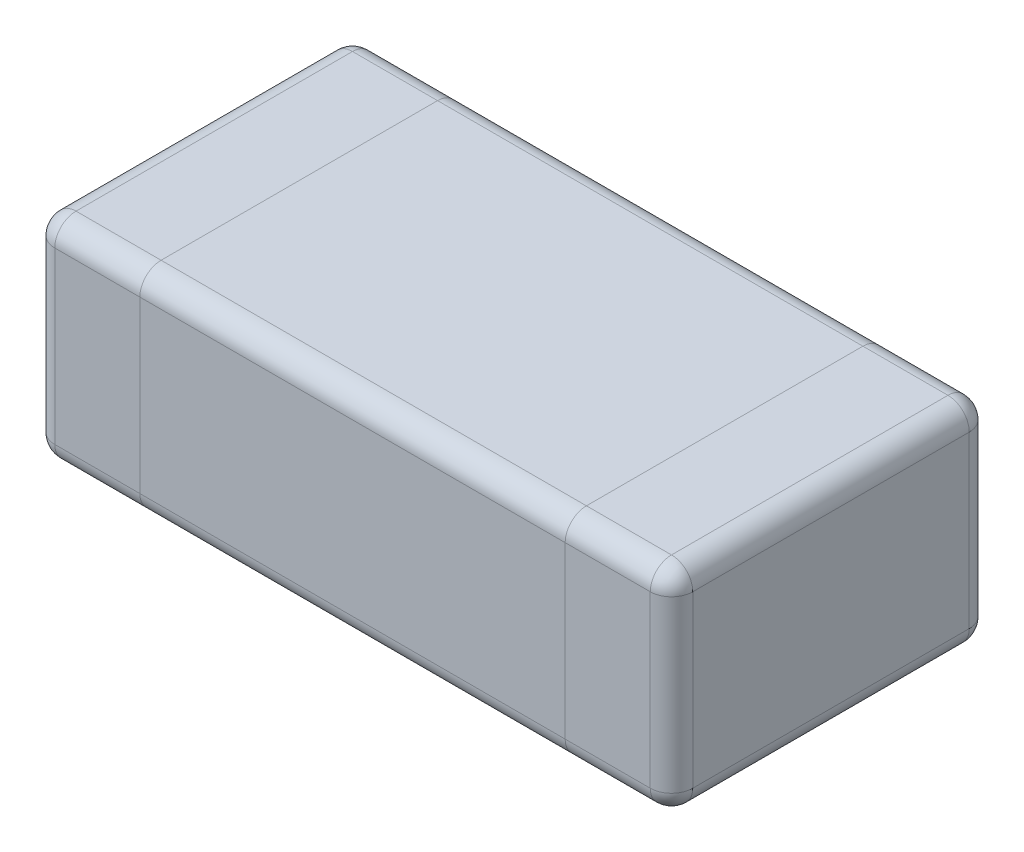
from build123d import *

# Parameters (mm, degrees)
SKETCH1_W           = 0.4
SKETCH1_H           = 0.2
BOSS_EXTRUDE1_DEPTH = 0.3
FILLET1_R           = 0.02
BOSS_EXTRUDE2_DEPTH = 0.1
FILLET2_R           = 0.02


with BuildPart() as part:
    # Sketch1 → Boss-Extrude1 (new body)
    with BuildSketch(Plane.XY):
        with Locations((0, 0.1)):
            Rectangle(SKETCH1_W, SKETCH1_H)
    extrude(amount=BOSS_EXTRUDE1_DEPTH)

    # Fillet1
    fillet1_edges = [part.edges().sort_by_distance(p)[0] for p in [
        (0, 0.2, 0.3),
        (0, 0.2, 0),
        (0, 0, 0),
        (0, 0, 0.3),
    ]]
    fillet(fillet1_edges, radius=FILLET1_R)


with BuildPart() as body_2:
    # Sketch2 → Boss-Extrude2 (new body)
    with BuildSketch(Plane.ZY.offset(0.2)):
        with BuildLine():
            Line((0, 0.18), (0, 0.02))
            ThreePointArc((0, 0.02), (0.005857864, 0.005857864), (0.02, 0))
            Line((0.02, 0), (0.28, 0))
            ThreePointArc((0.28, 0), (0.294142136, 0.005857864), (0.3, 0.02))
            Line((0.3, 0.02), (0.3, 0.18))
            ThreePointArc((0.3, 0.18), (0.294142136, 0.194142136), (0.28, 0.2))
            Line((0.28, 0.2), (0.02, 0.2))
            ThreePointArc((0.02, 0.2), (0.005857864, 0.194142136), (0, 0.18))
        make_face()
    extrude(amount=BOSS_EXTRUDE2_DEPTH)

    # Fillet2
    fillet2_edges = [body_2.edges().sort_by_distance(p)[0] for p in [
        (-0.3, 0.005857864, 0.005857864),
        (-0.3, 0, 0.15),
        (-0.3, 0.005857864, 0.294142136),
        (-0.3, 0.1, 0.3),
        (-0.3, 0.194142136, 0.294142136),
        (-0.3, 0.2, 0.15),
        (-0.3, 0.194142136, 0.005857864),
        (-0.3, 0.1, 0),
    ]]
    fillet(fillet2_edges, radius=FILLET2_R)


with BuildPart() as body_3:
    # Mirror1: mirrored copy
    add(body_2.part.mirror(Plane(origin=(0, 0, 0), x_dir=(0, 0, 1), z_dir=(1, 0, 0))))


solid = Compound([part.part, body_2.part, body_3.part])
